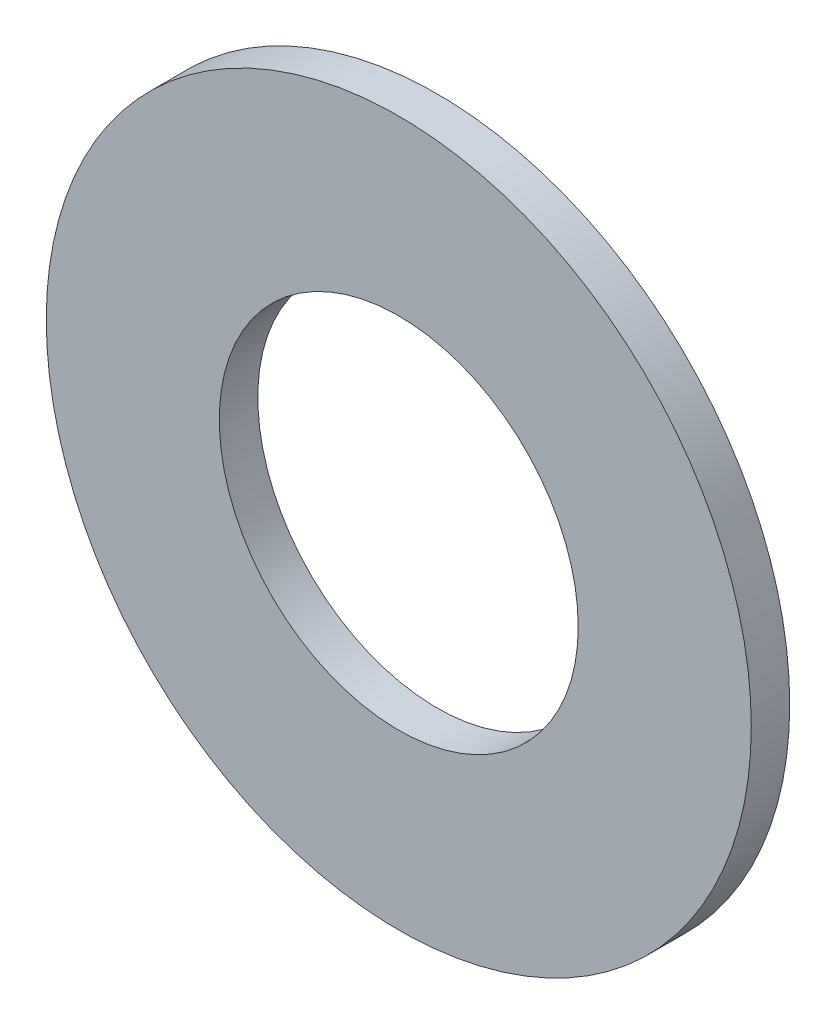
from build123d import *

# Parameters (mm, degrees)
SKETCH_1_R      = 27.5
SKETCH_1_R_2    = 14
EXTRUDE_1_DEPTH = 3


with BuildPart() as part:
    # 草图1 → 凸台-拉伸1 (new body)
    with BuildSketch(Plane.XY):
        Circle(SKETCH_1_R)
        Circle(SKETCH_1_R_2, mode=Mode.SUBTRACT)
    extrude(amount=EXTRUDE_1_DEPTH)


solid = part.part
